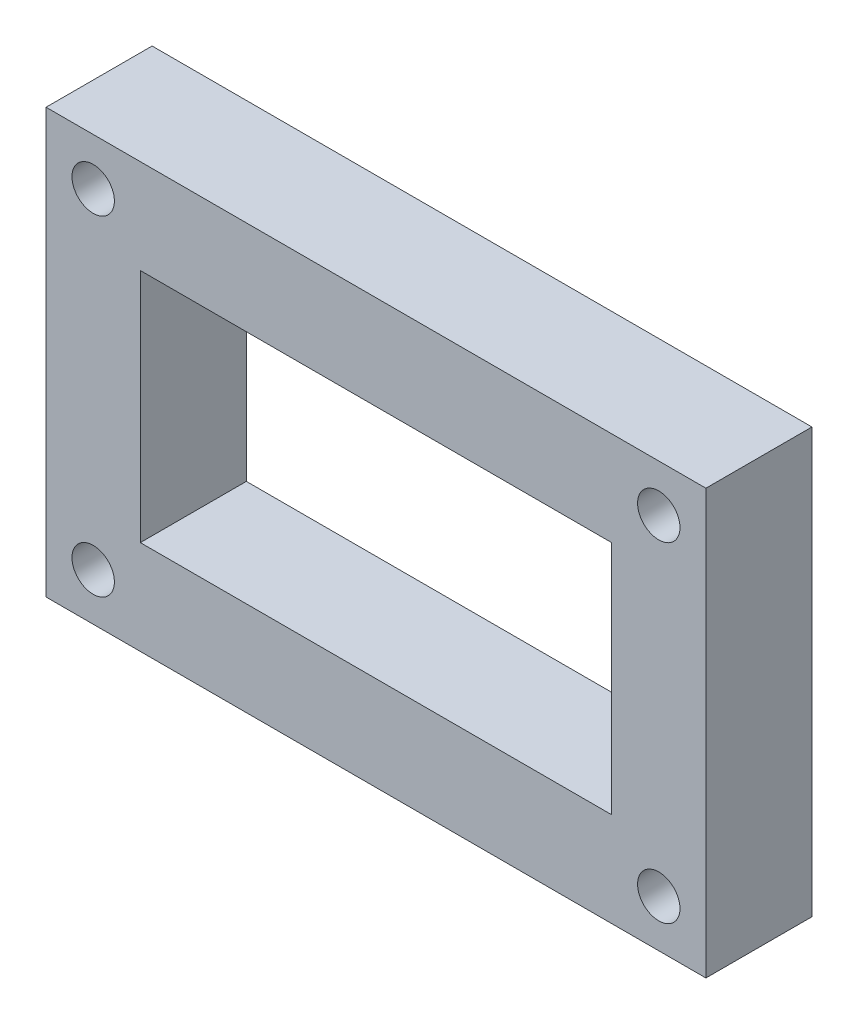
from build123d import *

# Parameters (mm, degrees)
SKETCH1_W           = 71.12
SKETCH1_H           = 45.72
SKETCH1_R           = 2.286
SKETCH1_W_2         = 50.8
SKETCH1_H_2         = 25.4
BOSS_EXTRUDE1_DEPTH = 11.43


with BuildPart() as part:
    # Sketch1 → Boss-Extrude1 (new body)
    with BuildSketch(Plane.XY):
        Rectangle(SKETCH1_W, SKETCH1_H)
        with Locations((-30.48, 17.78)):
            Circle(SKETCH1_R, mode=Mode.SUBTRACT)
        with Locations((-30.48, -17.78)):
            Circle(SKETCH1_R, mode=Mode.SUBTRACT)
        with Locations((30.48, -17.78)):
            Circle(SKETCH1_R, mode=Mode.SUBTRACT)
        with Locations((30.48, 17.78)):
            Circle(SKETCH1_R, mode=Mode.SUBTRACT)
        Rectangle(SKETCH1_W_2, SKETCH1_H_2, mode=Mode.SUBTRACT)
    extrude(amount=BOSS_EXTRUDE1_DEPTH)


solid = part.part
